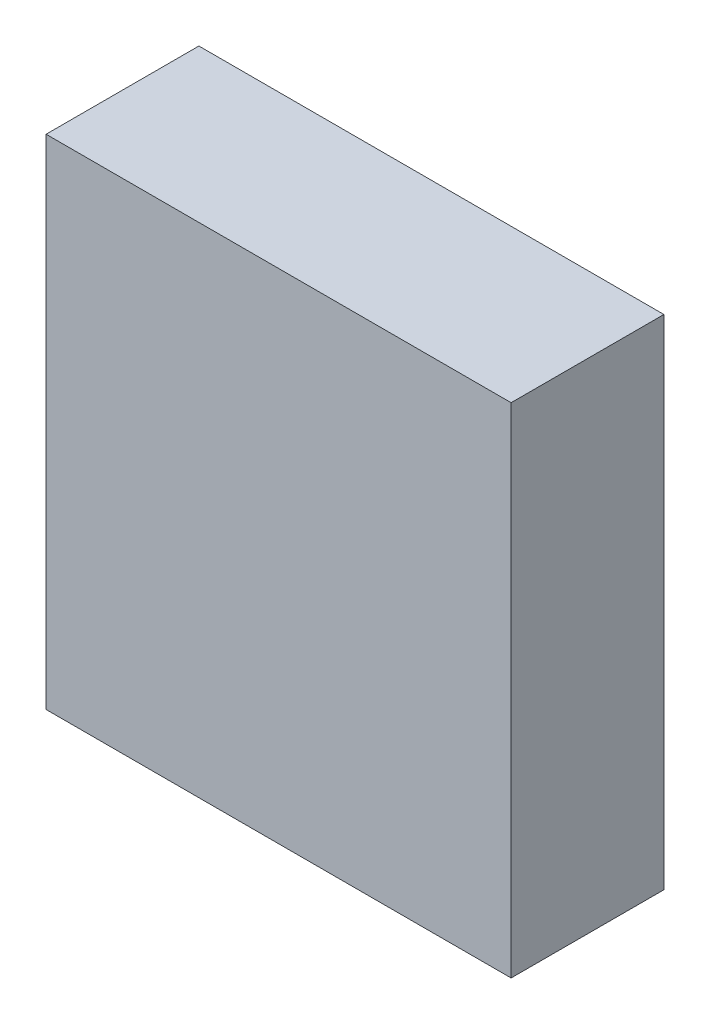
from build123d import *

# Parameters (mm, degrees)
ESBO_O1_W                = 70
ESBO_O1_H                = 75
RESSALTO_EXTRUS_O1_DEPTH = 23


with BuildPart() as part:
    # Esboço1 → Ressalto-extrusão1 (new body)
    with BuildSketch(Plane.XY):
        with Locations((-35.663190528, 28.332668977)):
            Rectangle(ESBO_O1_W, ESBO_O1_H)
    extrude(amount=RESSALTO_EXTRUS_O1_DEPTH)


solid = part.part
